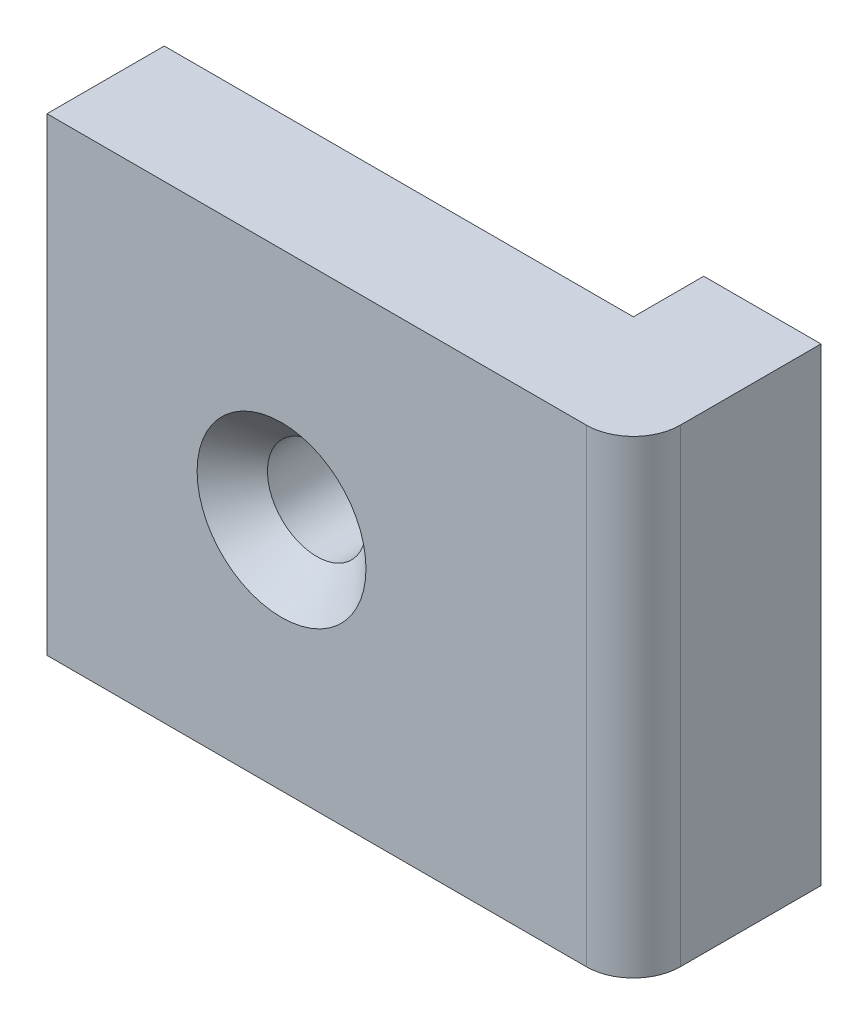
from build123d import *

# Parameters (mm, degrees)
SKETCH_2_W      = 20
SKETCH_2_H      = 20
SKETCH_2_R      = 2.1
EXTRUDE_1_DEPTH = 5
SKETCH_3_W      = 8
SKETCH_3_H      = 20
EXTRUDE_2_DEPTH = 5
FILLET_2_R      = 2
SKETCH_4_W      = 3
SKETCH_4_H      = 5.5
EXTRUDE_3_DEPTH = 3
CHAMFER_1_SIZE  = 1.5


with BuildPart() as part:
    # ｽｹｯﾁ2 → ﾎﾞｽ - 押し出し1 (new body)
    with BuildSketch(Plane.XY):
        Rectangle(SKETCH_2_W, SKETCH_2_H)
        Circle(SKETCH_2_R, mode=Mode.SUBTRACT)
    extrude(amount=EXTRUDE_1_DEPTH)

    # ｽｹｯﾁ3 → ﾎﾞｽ - 押し出し2 (add)
    with BuildSketch(Plane(origin=(10, 0, 0), x_dir=(0, 0, -1), z_dir=(1, 0, 0))):
        with Locations((-1, 0)):
            Rectangle(SKETCH_3_W, SKETCH_3_H)
    extrude(amount=EXTRUDE_2_DEPTH)

    # ﾌｨﾚｯﾄ2
    fillet_2_edges = [part.edges().sort_by_distance(p)[0] for p in [
        (15, 0, 5),
    ]]
    fillet(fillet_2_edges, radius=FILLET_2_R)

    # ｽｹｯﾁ4 → ﾎﾞｽ - 押し出し3 (add)
    with BuildSketch(Plane(origin=(0, 0, 0), x_dir=(-1, 0, 0), z_dir=(0, 0, -1))):
        with Locations((-8.5, 0)):
            Rectangle(SKETCH_4_W, SKETCH_4_H)
    extrude(amount=EXTRUDE_3_DEPTH)

    # 面取り1
    chamfer_1_edges = [part.edges().sort_by_distance(p)[0] for p in [
        (-2.1, 0, 5),
    ]]
    chamfer(chamfer_1_edges, length=CHAMFER_1_SIZE)


solid = part.part
